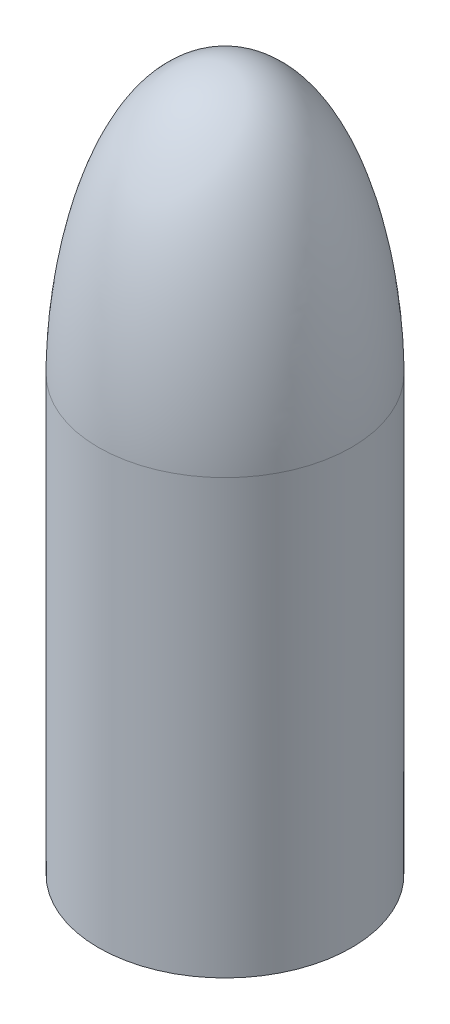
from build123d import *

# Parameters (mm, degrees)
SKETCH1_R           = 36.5
SKETCH1_R_2         = 35
BOSS_EXTRUDE1_DEPTH = 125


with BuildPart() as part:
    # Sketch1 → Boss-Extrude1 (new body)
    with BuildSketch(Plane(origin=(0, 0, 0), x_dir=(1, 0, 0), z_dir=(0, 1, 0))):
        with Locations(Location((0, 0, 0), (0, 0, 270))):
            Circle(SKETCH1_R)
        with Locations(Location((0, 0, 0), (0, 0, 270))):
            Circle(SKETCH1_R_2, mode=Mode.SUBTRACT)
    extrude(amount=BOSS_EXTRUDE1_DEPTH)

    # Sketch2 → Revolve1 (revolve)
    with BuildSketch(Plane.XY, mode=Mode.PRIVATE) as revolve1_sk:
        with BuildLine():
            Line((-35, 125), (-36.5, 125))
            add(Edge.make_bspline(
                [(-36.5, 125), (-36.5, 125.997585893), (-36.479353487, 127.975851313), (-36.354676949, 132.066342852), (-36.040929773, 137.305804837), (-35.406513032, 143.743673364), (-34.209220656, 152.406457609), (-32.03916465, 163.18021492), (-28.305361805, 175.356614503), (-23.375969665, 186.122826782), (-18.18984691, 193.376473422), (-13.312480535, 197.796637624), (-9.271161466, 200.314127167), (-5.574855016, 201.647181738), (-2.450710136, 202.19561005), (-0.811820943, 202.289236321), (0, 202.289236321)],
                knots=[0, 0, 0, 0, 0.03125, 0.0625, 0.125, 0.1875, 0.25, 0.375, 0.5, 0.625, 0.75, 0.8125, 0.875, 0.9375, 0.96875, 1, 1, 1, 1], degree=3))
            Line((0, 202.289236321), (0, 200.789236321))
            add(Edge.make_bspline(
                [(-35, 125), (-35, 156.192184687), (-24.540830293, 200.789236321), (0, 200.789236321)],
                knots=[0, 0, 0, 0, 1, 1, 1, 1], degree=3))
        make_face()
    revolve(revolve1_sk.sketch.rotate(Axis((0, 125, 0), (0, 1, 0)), 270), axis=Axis((0, 125, 0), (0, 1, 0)))


solid = part.part
